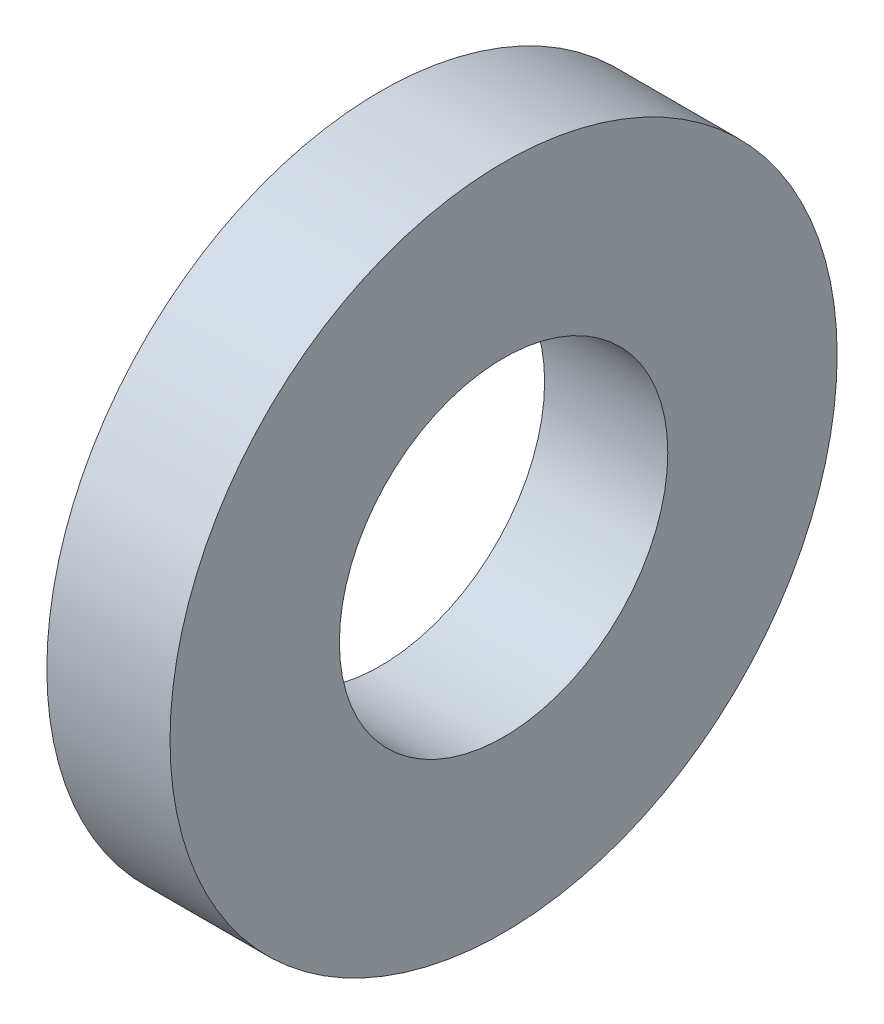
from build123d import *

# Parameters (mm, degrees)
SKETCH1_R           = 6.5
SKETCH1_R_2         = 3.2
BOSS_EXTRUDE1_DEPTH = 2.4


with BuildPart() as part:
    # Sketch1 → Boss-Extrude1 (new body)
    with BuildSketch(Plane(origin=(0, 0, 0), x_dir=(0, 0, -1), z_dir=(1, 0, 0))):
        Circle(SKETCH1_R)
        Circle(SKETCH1_R_2, mode=Mode.SUBTRACT)
    extrude(amount=BOSS_EXTRUDE1_DEPTH)


solid = part.part
